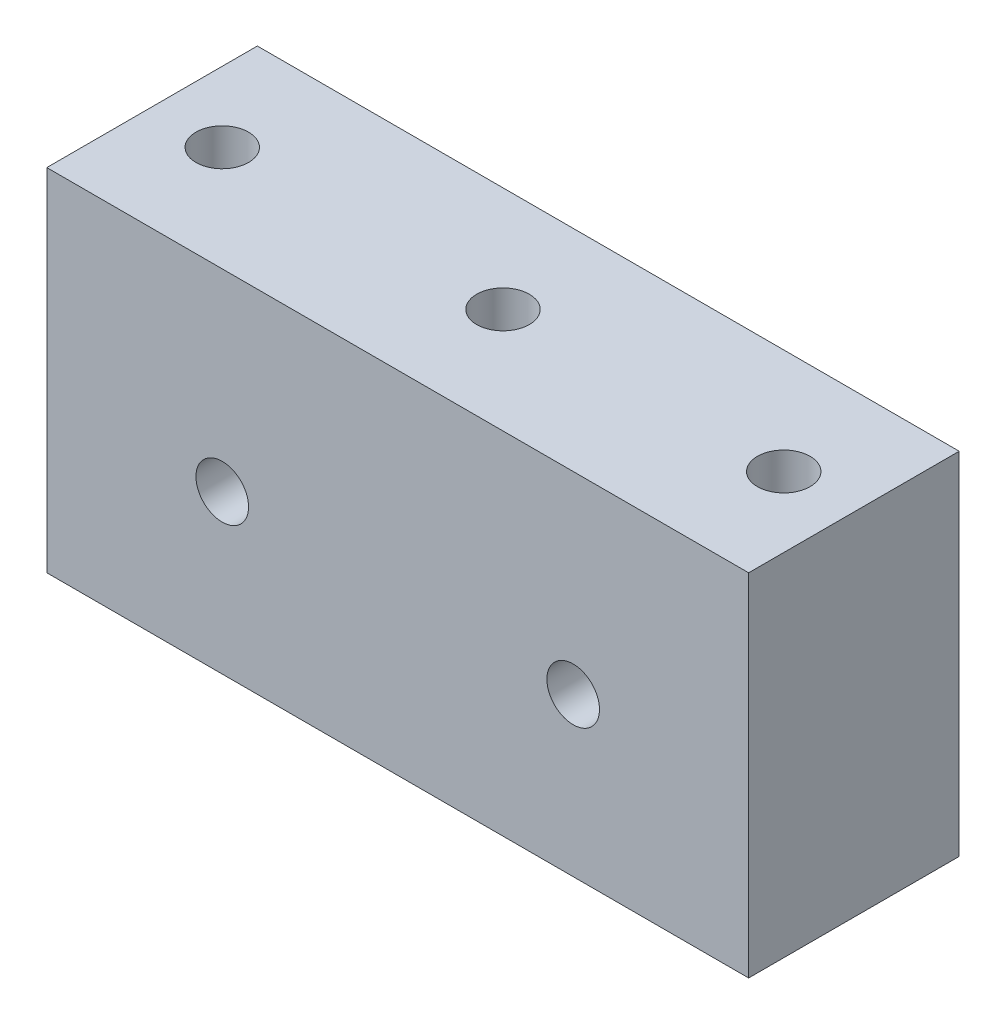
from build123d import *

# Parameters (mm, degrees)
SKETCH1_W           = 40
SKETCH1_H           = 12
SKETCH1_R           = 1.5
BOSS_EXTRUDE1_DEPTH = 20
SKETCH2_R           = 1.5
CUT_EXTRUDE1_DEPTH  = 20


with BuildPart() as part:
    # Sketch1 → Boss-Extrude1 (new body)
    with BuildSketch(Plane(origin=(0, 0, 0), x_dir=(1, 0, 0), z_dir=(0, 1, 0))):
        Rectangle(SKETCH1_W, SKETCH1_H)
        with Locations(Location((0, 0, 0), (0, 0, 270))):
            Circle(SKETCH1_R, mode=Mode.SUBTRACT)
        with Locations(Location((-16, 0, 0), (0, 0, 270))):
            Circle(SKETCH1_R, mode=Mode.SUBTRACT)
        with Locations(Location((16, 0, 0), (0, 0, 90))):
            Circle(SKETCH1_R, mode=Mode.SUBTRACT)
    extrude(amount=BOSS_EXTRUDE1_DEPTH)

    # Sketch2 → Cut-Extrude1 (cut)
    with BuildSketch(Plane(origin=(0, 0, -6), x_dir=(-1, 0, 0), z_dir=(0, 0, -1))):
        with Locations((10, 9)):
            Circle(SKETCH2_R)
        with Locations((-10, 9)):
            Circle(SKETCH2_R)
    extrude(amount=-CUT_EXTRUDE1_DEPTH, mode=Mode.SUBTRACT)


solid = part.part
